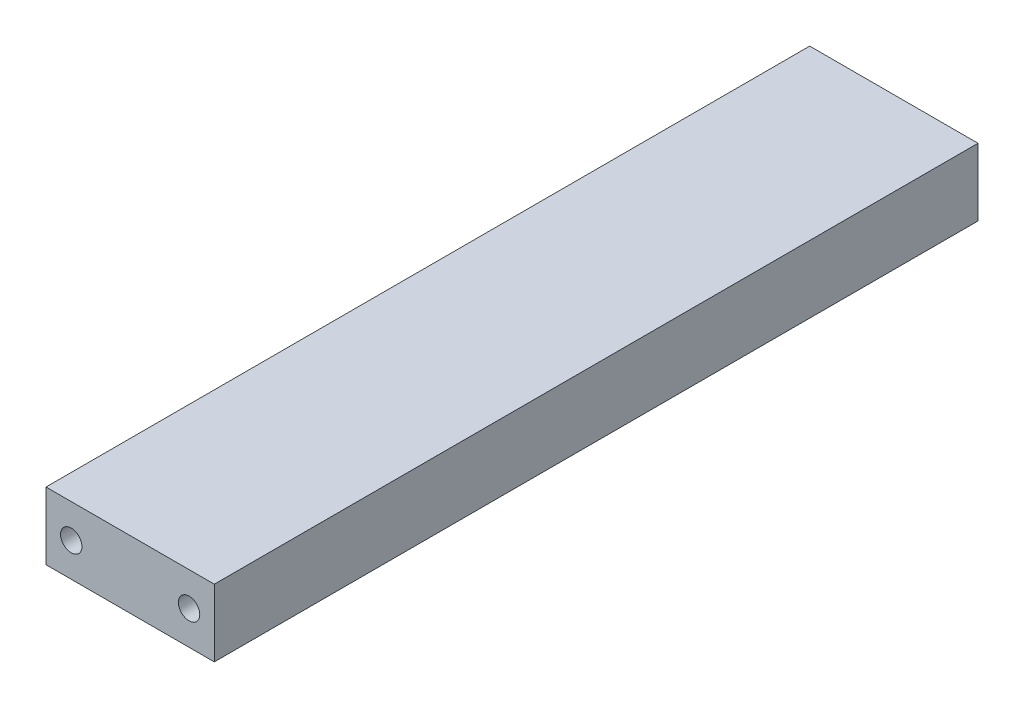
from build123d import *

# Parameters (mm, degrees)
SKETCH1_W                  = 31.75
SKETCH1_H                  = 12.7
BOSS_EXTRUDE1_DEPTH        = 144.065761159
F_10_32_TAPPED_HOLE1_D     = 4.0386
F_10_32_TAPPED_HOLE1_DEPTH = 12.03


with BuildPart() as part:
    # Sketch1 → Boss-Extrude1 (new body)
    with BuildSketch(Plane.XY):
        Rectangle(SKETCH1_W, SKETCH1_H)
    extrude(amount=BOSS_EXTRUDE1_DEPTH)

    # #10-32 Tapped Hole1
    with Locations(Plane(origin=(0, -9.125, 144.065761159), x_dir=(1, 0, 0), z_dir=(0, 0, 1))):
        with Locations((-11.1125, 9.125), (11.1125, 9.125)):
            f_10_32_tapped_hole1 = Hole(F_10_32_TAPPED_HOLE1_D / 2, depth=F_10_32_TAPPED_HOLE1_DEPTH)

    # Mirror1: #10-32 Tapped Hole1 across plane
    add(f_10_32_tapped_hole1.mirror(Plane.XY.offset(72.03288058)), mode=Mode.SUBTRACT)


solid = part.part
